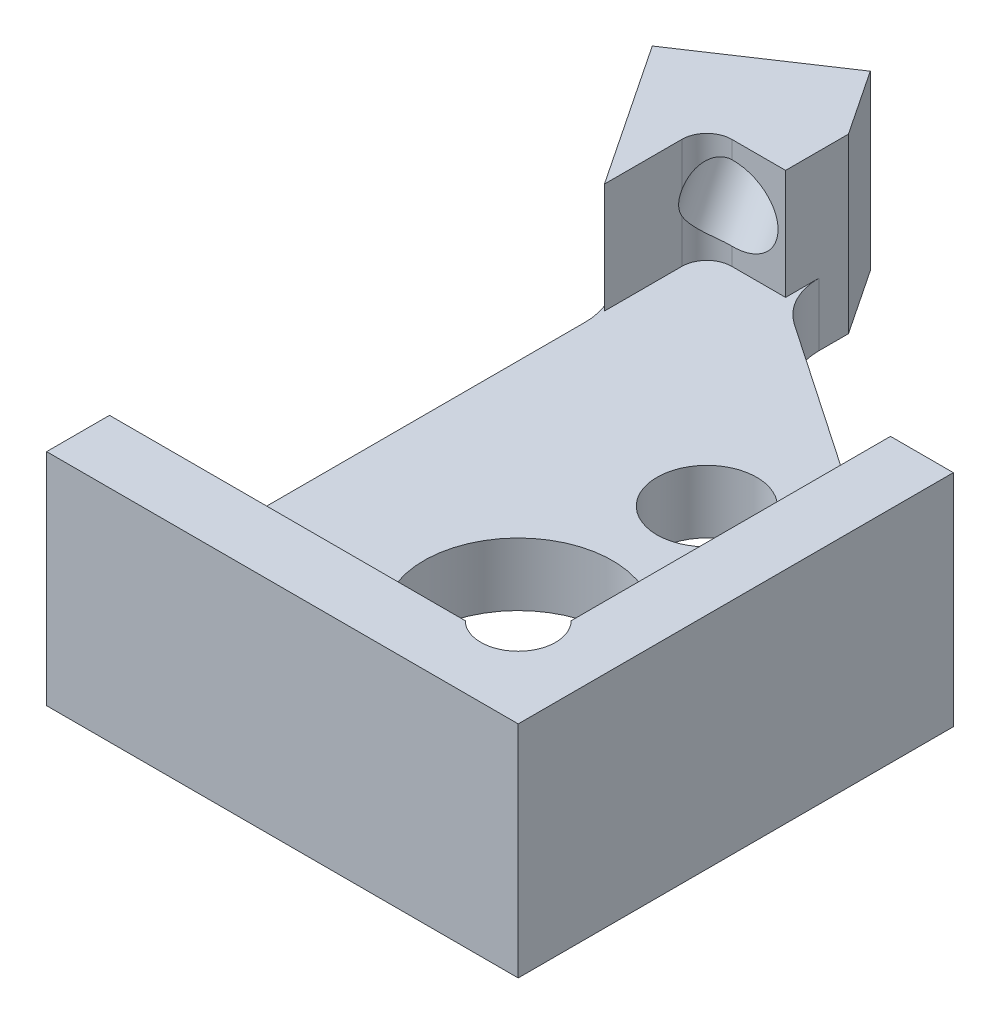
from build123d import *

# Parameters (mm, degrees)
SKETCH1_W                     = 8.5
SKETCH1_H                     = 11.5
BOSS_EXTRUDE1_DEPTH           = 3.5
SKETCH2_W                     = 6.5
SKETCH2_H                     = 9.5
CUT_EXTRUDE1_DEPTH            = 2.5
SKETCH3_R                     = 1.5
CUT_EXTRUDE2_DEPTH            = 8.574628704
SKETCH6_R                     = 0.5953125
CUT_EXTRUDE5_DEPTH            = 2.5
SKETCH7_R                     = 0.79375
CUT_EXTRUDE6_DEPTH            = 8.574628704
BOSS_EXTRUDE2_DEPTH           = 3.5
SKETCH14_W                    = 5.965258944
SKETCH14_H                    = 5.132960456
CUT_EXTRUDE8_DEPTH            = 0.75
TAP_DRILL_FOR_0_80_TAP1_D     = 1.19126
TAP_DRILL_FOR_0_80_TAP1_DEPTH = 7.11
TAP_DRILL_FOR_0_80_TAP1_TIP   = 0.357890611
CUT_EXTRUDE7_REACH            = 11.006
FILLET5_R                     = 1
FILLET6_R                     = 0.396875


with BuildPart() as part:
    # Sketch1 → Boss-Extrude1 (new body)
    with BuildSketch(Plane(origin=(0, 0, 0), x_dir=(1, 0, 0), z_dir=(0, 1, 0))):
        Rectangle(SKETCH1_W, SKETCH1_H)
    extrude(amount=BOSS_EXTRUDE1_DEPTH)

    # Sketch2 → Cut-Extrude1 (cut)
    with BuildSketch(Plane(origin=(0, 3.5, 0), x_dir=(1, 0, 0), z_dir=(0, 1, 0))):
        Rectangle(SKETCH2_W, SKETCH2_H)
    extrude(amount=-CUT_EXTRUDE1_DEPTH, mode=Mode.SUBTRACT)

    # Sketch3 → Cut-Extrude2 (cut, through all)
    with BuildSketch(Plane(origin=(0, 1, 0), x_dir=(1, 0, 0), z_dir=(0, 1, 0))):
        with Locations(Location((0.25, -1.75, 0), (0, 0, 270))):
            Circle(SKETCH3_R)
    extrude(amount=-CUT_EXTRUDE2_DEPTH, mode=Mode.SUBTRACT)

    # Sketch6 → Cut-Extrude5 (cut)
    with BuildSketch(Plane(origin=(0, 3.5, 0), x_dir=(1, 0, 0), z_dir=(0, 1, 0))):
        with Locations((2.829050494, -4.329050494)):
            Circle(SKETCH6_R)
    extrude(amount=-CUT_EXTRUDE5_DEPTH, mode=Mode.SUBTRACT)

    # Sketch7 → Cut-Extrude6 (cut, through all)
    with BuildSketch(Plane(origin=(0, 1, 0), x_dir=(1, 0, 0), z_dir=(0, 1, 0))):
        with Locations(Location((0.25, 1.25, 0), (0, 0, 270))):
            Circle(SKETCH7_R)
        with Locations(Location((-1.625, -3.5, 0), (0, 0, 270))):
            Circle(SKETCH7_R)
        with Locations(Location((2.125, -3.5, 0), (0, 0, 270))):
            Circle(SKETCH7_R)
    extrude(amount=-CUT_EXTRUDE6_DEPTH, mode=Mode.SUBTRACT)

    # Sketch9 → Boss-Extrude2 (add)
    with BuildSketch(Plane(origin=(0, 3.5, 0), x_dir=(1, 0, 0), z_dir=(0, 1, 0))):
        Polygon((-2.69064642, 6.789569053), (-4.770772156, 5.402818562), (-4.001541387, 4.248972409), (-3.411634369, 4.642243754), (-2.511322669, 5.242451554), (-1.921415651, 5.635722899), align=None)
    extrude(amount=-BOSS_EXTRUDE2_DEPTH)

    # Sketch14 → Cut-Extrude8 (cut)
    with BuildSketch(Plane(origin=(0, 3.5, 0), x_dir=(1, 0, 0), z_dir=(0, 1, 0))):
        with Locations((-3.25, 4.75)):
            Rectangle(SKETCH14_W, SKETCH14_H)
    extrude(amount=-CUT_EXTRUDE8_DEPTH, mode=Mode.SUBTRACT)

    # Tap Drill for #0-80 Tap1
    with Locations(Plane(origin=(-3.961538462, 0, -5.942307692), x_dir=(-0.8320502943378434, 0, 0.5547001962252295), z_dir=(-0.5547001962252295, 0, -0.8320502943378434))):
        with Locations((-0.27742214, 1.875)):
            Hole(TAP_DRILL_FOR_0_80_TAP1_D / 2, depth=TAP_DRILL_FOR_0_80_TAP1_DEPTH)
            with Locations((0, 0, -(TAP_DRILL_FOR_0_80_TAP1_DEPTH + TAP_DRILL_FOR_0_80_TAP1_TIP / 2))):  # 118° drill point
                Cone(0, TAP_DRILL_FOR_0_80_TAP1_D / 2, TAP_DRILL_FOR_0_80_TAP1_TIP, mode=Mode.SUBTRACT)

    # Sketch13 → Cut-Extrude7 (cut, up to next)
    with BuildSketch(Plane(origin=(0, 3.5, 0), x_dir=(1, 0, 0), z_dir=(0, 1, 0)), mode=Mode.PRIVATE) as cut_extrude7_sk1:
        Polygon((-1.997600385, 5.75), (-1.997600385, 4.75), (3.25, 1.170806318), (4.25, 1.170806318), (4.25, 5.75), align=None)
    cut_extrude7_tool1 = extrude(cut_extrude7_sk1.sketch, amount=-CUT_EXTRUDE7_REACH, mode=Mode.PRIVATE) & part.part
    # Sketch13 → Cut-Extrude7 (cut, up to next)
    with BuildSketch(Plane(origin=(0, 3.5, 0), x_dir=(1, 0, 0), z_dir=(0, 1, 0)), mode=Mode.PRIVATE) as cut_extrude7_sk2:
        Polygon((-4.25, 4.621660328), (-3.25, 3.121660328), (-3.25, -5.75), (-4.25, -5.75), align=None)
    cut_extrude7_tool2 = extrude(cut_extrude7_sk2.sketch, amount=-CUT_EXTRUDE7_REACH, mode=Mode.PRIVATE) & part.part
    add(cut_extrude7_tool1.solids().sort_by_distance((1.797917, 3.5, -3.996239))[0], mode=Mode.SUBTRACT)
    add(cut_extrude7_tool2.solids().sort_by_distance((-3.762992, 3.5, 0.929426))[0], mode=Mode.SUBTRACT)

    # Fillet5
    fillet5_edges = [part.edges().sort_by_distance(p)[0] for p in [
        (3.25, 0.5, -1.170806318),
        (-1.997600385, 0.5, -4.75),
        (-3.25, 0.5, -3.121660328),
    ]]
    fillet(fillet5_edges, radius=FILLET5_R)

    # Fillet6
    fillet6_edges = [part.edges().sort_by_distance(p)[0] for p in [
        (-3.25, 1.195357051, -4.75),
        (-3.25, 2.554642949, -4.75),
    ]]
    fillet(fillet6_edges, radius=FILLET6_R)


solid = part.part
